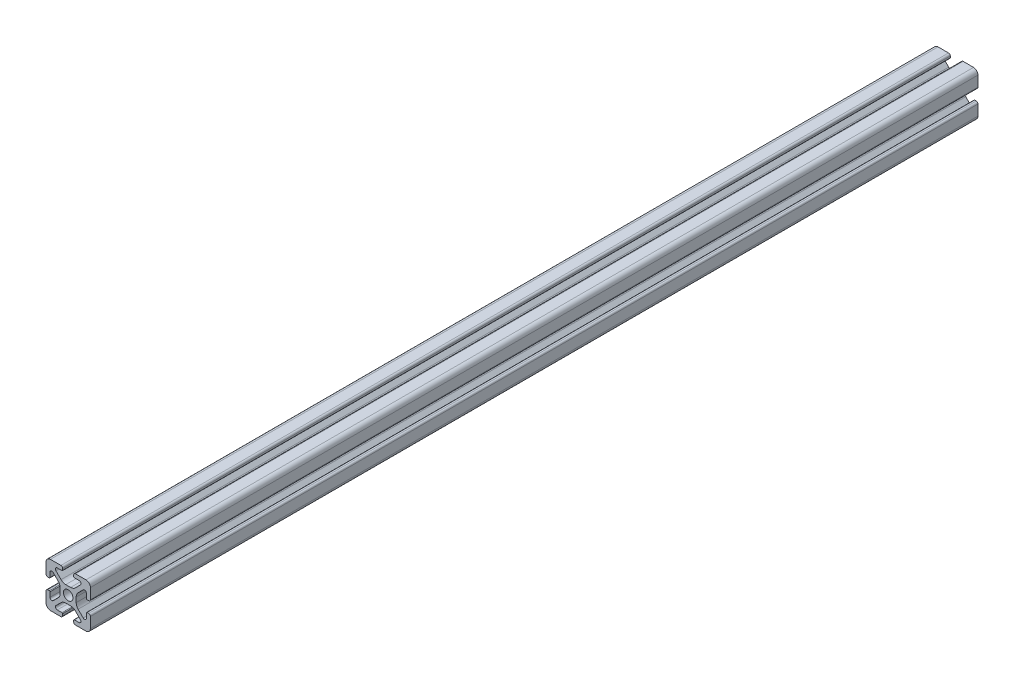
from build123d import *

# Parameters (mm, degrees)
BOSS_EXTRUDE1_DEPTH      = 200
BOSS_EXTRUDE1_DEPTH_BACK = 200
SKETCH3_R                = 2.15


with BuildPart() as part:
    # Sketch3 → Boss-Extrude1 (new, two sides: drawn at the far end of the back side and taken through both)
    with BuildSketch(Plane.XY.offset(-BOSS_EXTRUDE1_DEPTH_BACK)):
        with BuildLine():
            Line((3.2874, 10), (8, 10))
            ThreePointArc((8, 10), (9.414213562, 9.414213562), (10, 8))
            Line((10, 8), (10, 3.2874))
            ThreePointArc((10, 3.2874), (9.76937588, 2.73062412), (9.2126, 2.5))
            Line((9.2126, 2.5), (8.5048, 2.5))
            ThreePointArc((8.5048, 2.5), (8.289273853, 2.589273853), (8.2, 2.8048))
            Line((8.2, 2.8048), (8.2, 4.9118))
            ThreePointArc((8.2, 4.9118), (7.682565253, 5.686195824), (6.769103096, 5.504496904))
            Line((6.769103096, 5.504496904), (4.478679656, 3.214073464))
            ThreePointArc((4.478679656, 3.214073464), (3.828361402, 2.240803418), (3.6, 1.092753121))
            Line((3.6, 1.092753121), (3.6, -1.092753121))
            ThreePointArc((3.6, -1.092753121), (3.828361402, -2.240803418), (4.478679656, -3.214073464))
            Line((4.478679656, -3.214073464), (6.769103096, -5.504496904))
            ThreePointArc((6.769103096, -5.504496904), (7.682565253, -5.686195824), (8.2, -4.9118))
            Line((8.2, -4.9118), (8.2, -2.8048))
            ThreePointArc((8.2, -2.8048), (8.289273853, -2.589273853), (8.5048, -2.5))
            Line((8.5048, -2.5), (9.2126, -2.5))
            ThreePointArc((9.2126, -2.5), (9.76937588, -2.73062412), (10, -3.2874))
            Line((10, -3.2874), (10, -8))
            ThreePointArc((10, -8), (9.414213562, -9.414213562), (8, -10))
            Line((8, -10), (3.2874, -10))
            ThreePointArc((3.2874, -10), (2.73062412, -9.76937588), (2.5, -9.2126))
            Line((2.5, -9.2126), (2.5, -8.5048))
            ThreePointArc((2.5, -8.5048), (2.589273853, -8.289273853), (2.8048, -8.2))
            Line((2.8048, -8.2), (4.9118, -8.2))
            ThreePointArc((4.9118, -8.2), (5.686195824, -7.682565253), (5.504496904, -6.769103096))
            Line((5.504496904, -6.769103096), (3.214073464, -4.478679656))
            ThreePointArc((3.214073464, -4.478679656), (2.240803418, -3.828361402), (1.092753121, -3.6))
            Line((1.092753121, -3.6), (-1.092753121, -3.6))
            ThreePointArc((-1.092753121, -3.6), (-2.240803418, -3.828361402), (-3.214073464, -4.478679656))
            Line((-3.214073464, -4.478679656), (-5.504496904, -6.769103096))
            ThreePointArc((-5.504496904, -6.769103096), (-5.686195824, -7.682565253), (-4.9118, -8.2))
            Line((-4.9118, -8.2), (-2.8048, -8.2))
            ThreePointArc((-2.8048, -8.2), (-2.589273853, -8.289273853), (-2.5, -8.5048))
            Line((-2.5, -8.5048), (-2.5, -9.2126))
            ThreePointArc((-2.5, -9.2126), (-2.73062412, -9.76937588), (-3.2874, -10))
            Line((-3.2874, -10), (-8, -10))
            ThreePointArc((-8, -10), (-9.414213562, -9.414213562), (-10, -8))
            Line((-10, -8), (-10, -3.2874))
            ThreePointArc((-10, -3.2874), (-9.76937588, -2.73062412), (-9.2126, -2.5))
            Line((-9.2126, -2.5), (-8.5048, -2.5))
            ThreePointArc((-8.5048, -2.5), (-8.289273853, -2.589273853), (-8.2, -2.8048))
            Line((-8.2, -2.8048), (-8.2, -4.9118))
            ThreePointArc((-8.2, -4.9118), (-7.682565253, -5.686195824), (-6.769103096, -5.504496904))
            Line((-6.769103096, -5.504496904), (-4.478679656, -3.214073464))
            ThreePointArc((-4.478679656, -3.214073464), (-3.828361402, -2.240803418), (-3.6, -1.092753121))
            Line((-3.6, -1.092753121), (-3.6, 1.092753121))
            ThreePointArc((-3.6, 1.092753121), (-3.828361402, 2.240803418), (-4.478679656, 3.214073464))
            Line((-4.478679656, 3.214073464), (-6.769103096, 5.504496904))
            ThreePointArc((-6.769103096, 5.504496904), (-7.682565253, 5.686195824), (-8.2, 4.9118))
            Line((-8.2, 4.9118), (-8.2, 2.8048))
            ThreePointArc((-8.2, 2.8048), (-8.289273853, 2.589273853), (-8.5048, 2.5))
            Line((-8.5048, 2.5), (-9.2126, 2.5))
            ThreePointArc((-9.2126, 2.5), (-9.76937588, 2.73062412), (-10, 3.2874))
            Line((-10, 3.2874), (-10, 8))
            ThreePointArc((-10, 8), (-9.414213562, 9.414213562), (-8, 10))
            Line((-8, 10), (-3.2874, 10))
            ThreePointArc((-3.2874, 10), (-2.73062412, 9.76937588), (-2.5, 9.2126))
            Line((-2.5, 9.2126), (-2.5, 8.5048))
            ThreePointArc((-2.5, 8.5048), (-2.589273853, 8.289273853), (-2.8048, 8.2))
            Line((-2.8048, 8.2), (-4.9118, 8.2))
            ThreePointArc((-4.9118, 8.2), (-5.686195824, 7.682565253), (-5.504496904, 6.769103096))
            Line((-5.504496904, 6.769103096), (-3.214073464, 4.478679656))
            ThreePointArc((-3.214073464, 4.478679656), (-2.240803418, 3.828361402), (-1.092753121, 3.6))
            Line((-1.092753121, 3.6), (1.092753121, 3.6))
            ThreePointArc((1.092753121, 3.6), (2.240803418, 3.828361402), (3.214073464, 4.478679656))
            Line((3.214073464, 4.478679656), (5.504496904, 6.769103096))
            ThreePointArc((5.504496904, 6.769103096), (5.686195824, 7.682565253), (4.9118, 8.2))
            Line((4.9118, 8.2), (2.8048, 8.2))
            ThreePointArc((2.8048, 8.2), (2.589273853, 8.289273853), (2.5, 8.5048))
            Line((2.5, 8.5048), (2.5, 9.2126))
            ThreePointArc((2.5, 9.2126), (2.73062412, 9.76937588), (3.2874, 10))
        make_face()
        Circle(SKETCH3_R, mode=Mode.SUBTRACT)
    extrude(amount=BOSS_EXTRUDE1_DEPTH + BOSS_EXTRUDE1_DEPTH_BACK)


solid = part.part
